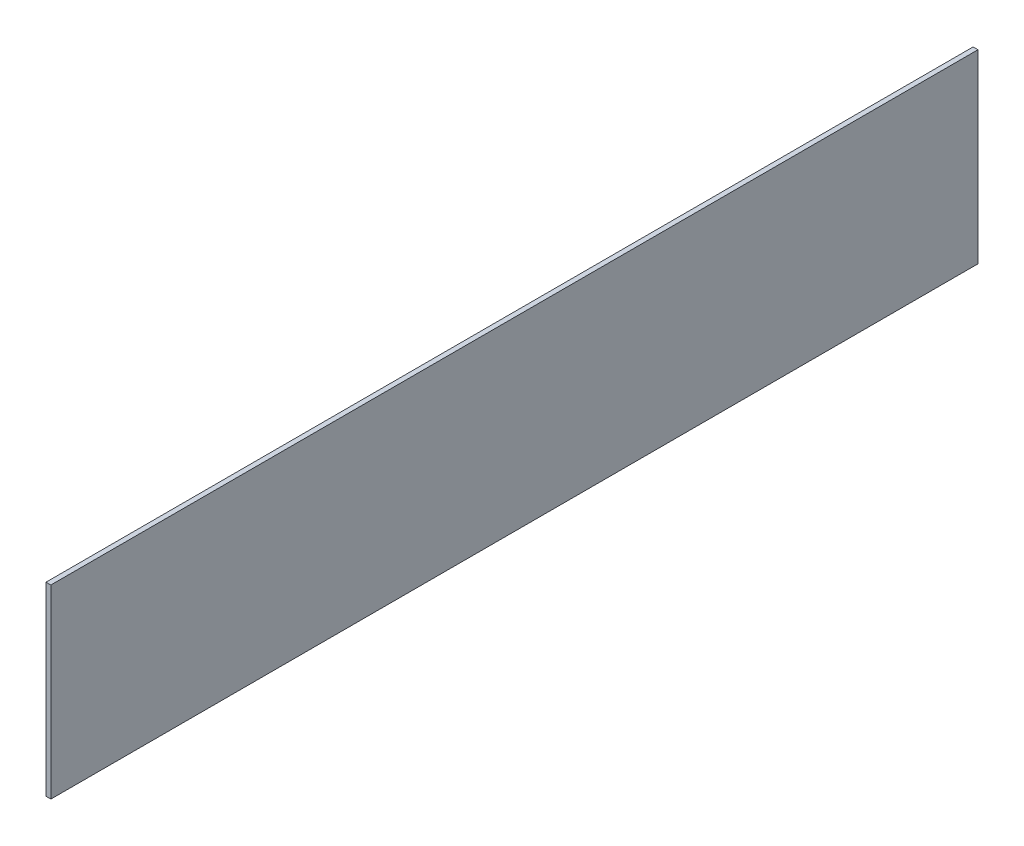
from build123d import *

# Parameters (mm, degrees)
SKETCH1_W           = 381
SKETCH1_H           = 76.2
BOSS_EXTRUDE1_DEPTH = 2.000000064


with BuildPart() as part:
    # Sketch1 → Boss-Extrude1 (new body)
    with BuildSketch(Plane(origin=(0, 0, 0), x_dir=(0, 0, -1), z_dir=(1, 0, 0))):
        Rectangle(SKETCH1_W, SKETCH1_H)
    extrude(amount=BOSS_EXTRUDE1_DEPTH)


solid = part.part
